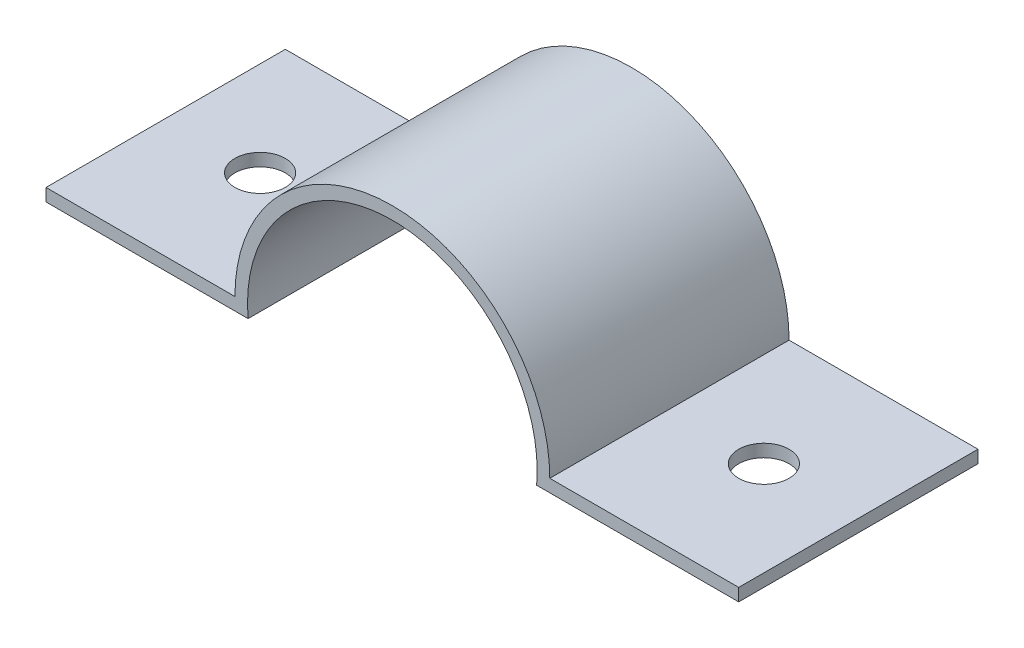
from build123d import *

# Parameters (mm, degrees)
Y_KSEKLIK_EKSTR_ZYON1_DEPTH = 19
IZIM2_R                     = 2
KES_EKSTR_ZYON1_DEPTH       = 19


with BuildPart() as part:
    # Çizim1 → Yükseklik-Ekstrüzyon1 (new body)
    with BuildSketch(Plane.XY):
        with BuildLine():
            Line((0, 0), (15, 0))
            ThreePointArc((15, 0), (27.5, 12.5), (40, 0))
            Line((40, 0), (55, 0))
            Line((55, 0), (55, -1))
            Line((55, -1), (38.956439237, -1))
            ThreePointArc((38.956439237, -1), (27.5, 11.5), (16.043560763, -1))
            Line((16.043560763, -1), (16, -1))
            Line((16, -1), (0, -1))
            Line((0, -1), (0, 0))
        make_face()
    extrude(amount=Y_KSEKLIK_EKSTR_ZYON1_DEPTH)

    # Çizim2 → Kes-Ekstrüzyon1 (cut)
    with BuildSketch(Plane(origin=(0, 0, 0), x_dir=(1, 0, 0), z_dir=(0, 1, 0))):
        with Locations(Location((7.5, -9.5, 0), (0, 0, 270))):
            Circle(IZIM2_R)
        with Locations(Location((47.5, -9.5, 0), (0, 0, 270))):
            Circle(IZIM2_R)
    extrude(amount=-KES_EKSTR_ZYON1_DEPTH, mode=Mode.SUBTRACT)


solid = part.part
